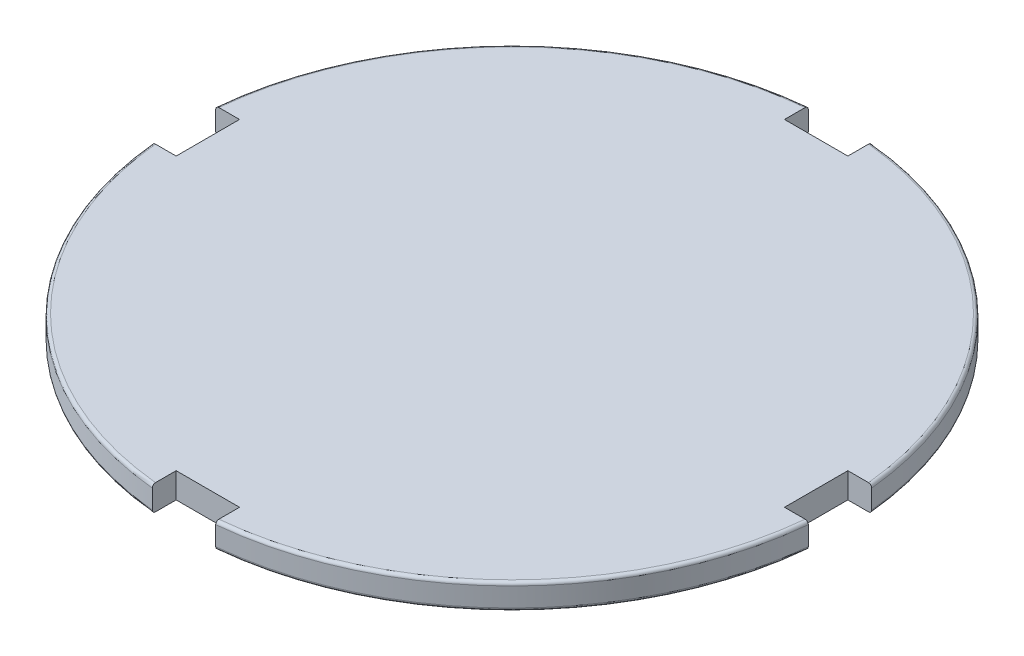
from build123d import *

# Parameters (mm, degrees)
SKETCH2_R           = 66.04
BOSS_EXTRUDE1_DEPTH = 5.08
FILLET1_R           = 0.635
SKETCH3_W           = 12.7
SKETCH3_H           = 15.225369524
SKETCH3_W_2         = 15.225369524
SKETCH3_H_2         = 12.7
CUT_EXTRUDE1_DEPTH  = 94.532719409


with BuildPart() as part:
    # Sketch2 → Boss-Extrude1 (new body)
    with BuildSketch(Plane(origin=(0, 0, 0), x_dir=(1, 0, 0), z_dir=(0, 1, 0))):
        with Locations(Location((0, 0, 0), (0, 0, 270))):
            Circle(SKETCH2_R)
    extrude(amount=BOSS_EXTRUDE1_DEPTH)

    # Fillet1
    fillet1_edges = [part.edges().sort_by_distance(p)[0] for p in [
        (0, 0, -66.04),
        (0, 5.08, -66.04),
    ]]
    fillet(fillet1_edges, radius=FILLET1_R)

    # Sketch3 → Cut-Extrude1 (cut, through all)
    with BuildSketch(Plane.XZ):
        with Locations((0, 68.572684762)):
            Rectangle(SKETCH3_W, SKETCH3_H)
        with Locations((68.572684762, 0)):
            Rectangle(SKETCH3_W_2, SKETCH3_H_2)
        with Locations((0, -68.572684762)):
            Rectangle(SKETCH3_W, SKETCH3_H)
        with Locations((-68.572684762, 0)):
            Rectangle(SKETCH3_W_2, SKETCH3_H_2)
    extrude(amount=-CUT_EXTRUDE1_DEPTH, mode=Mode.SUBTRACT)


solid = part.part
